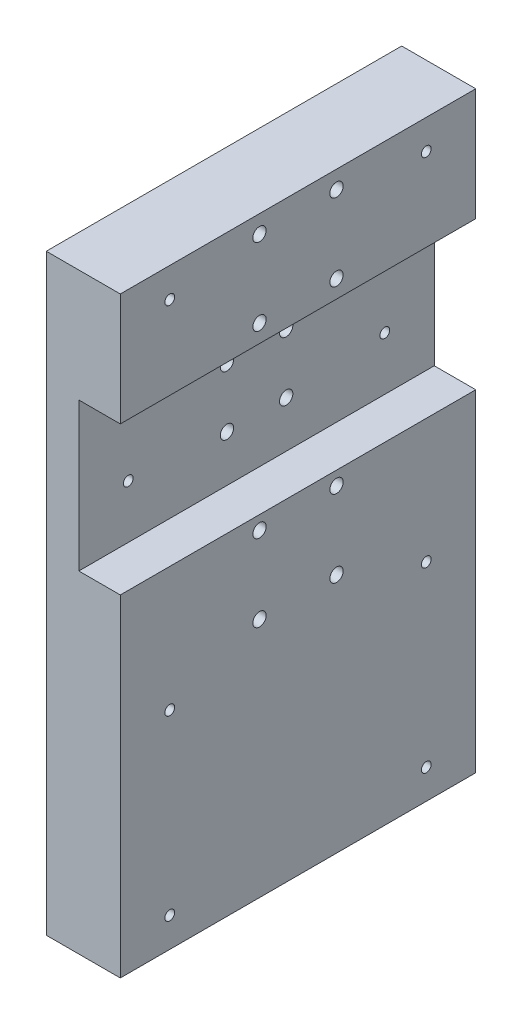
from build123d import *

# Parameters (mm, degrees)
BOSS_EXTRUDE1_DEPTH            = 120
CBORE_FOR_M4_SHCS4_D           = 4.5
CBORE_FOR_M4_SHCS4_CBORE_D     = 8
CBORE_FOR_M4_SHCS4_CBORE_DEPTH = 4
M4_TAPPED_HOLE1_D              = 3.3
M5_TAPPED_HOLE1_D              = 4.2
M5_TAPPED_HOLE1_DEPTH          = 17.4
M5_TAPPED_HOLE1_TIP            = 1.2618073


with BuildPart() as part:
    # Sketch1 → Boss-Extrude1 (new body)
    with BuildSketch(Plane.XY):
        Polygon((0, 0), (0, 200), (25, 200), (25, 162), (11, 162), (11, 112), (25, 112), (25, 0), align=None)
    extrude(amount=BOSS_EXTRUDE1_DEPTH)

    # CBORE for M4 SHCS4 (through all)
    with Locations(Plane(origin=(0, 194, 73), x_dir=(0, 0, -1), z_dir=(-1, 0, 0))):
        with Locations((0, 0), (0, 26), (3, 46.3), (3, 66.3), (0, 86.6), (0, 112.6), (26, 112.6), (26, 86.6), (23, 66.3), (23, 46.3), (26, 26), (26, 0)):
            CounterBoreHole(CBORE_FOR_M4_SHCS4_D / 2, CBORE_FOR_M4_SHCS4_CBORE_D / 2, CBORE_FOR_M4_SHCS4_CBORE_DEPTH)

    # M4 Tapped Hole1 (through all)
    with Locations(Plane(origin=(0, 190, 16.7), x_dir=(0, 0, -1), z_dir=(-1, 0, 0))):
        with Locations((0, 0), (0, 60), (0, 120), (0, 180), (-86.6, 180), (-86.6, 120), (-86.6, 60), (-86.6, 0)):
            Hole(M4_TAPPED_HOLE1_D / 2)

    # M5 Tapped Hole1
    with Locations(Plane(origin=(12.5, 0, 90), x_dir=(-1, 0, 0), z_dir=(0, -1, 0))):
        with Locations((0, 0), (0, 30), (0, 60)):
            Hole(M5_TAPPED_HOLE1_D / 2, depth=M5_TAPPED_HOLE1_DEPTH)
            with Locations((0, 0, -(M5_TAPPED_HOLE1_DEPTH + M5_TAPPED_HOLE1_TIP / 2))):  # 118° drill point
                Cone(0, M5_TAPPED_HOLE1_D / 2, M5_TAPPED_HOLE1_TIP, mode=Mode.SUBTRACT)


solid = part.part
